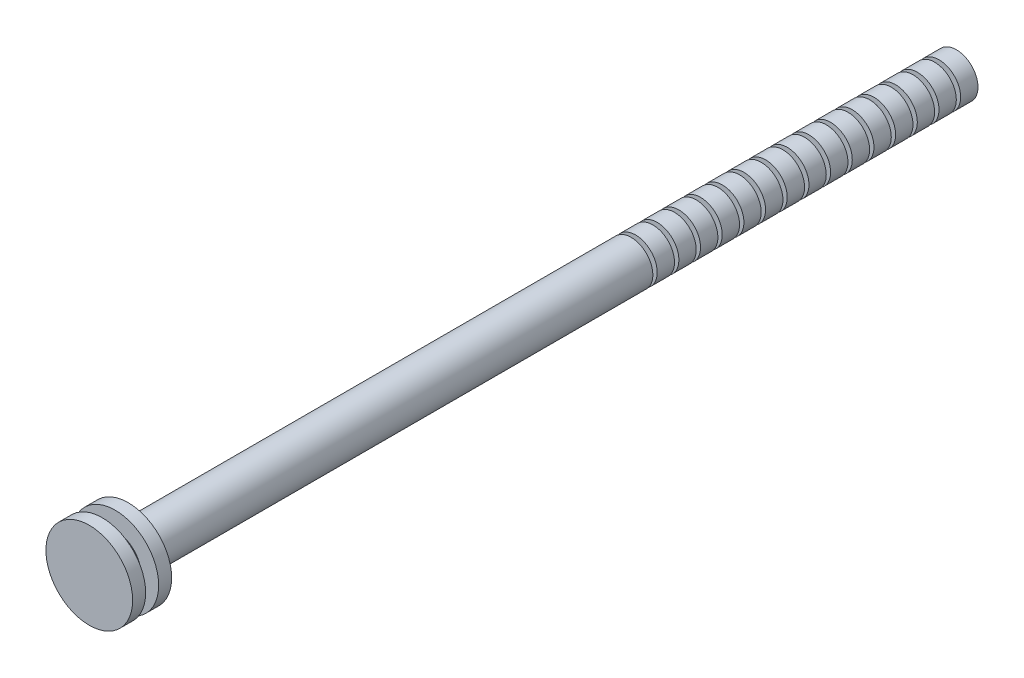
from build123d import *

# Parameters (mm, degrees)
SKETCH3_W       = 2
SKETCH3_H       = 1
LPATTERN1_COUNT = 15
LPATTERN1_PITCH = 5


with BuildPart() as part:
    # Sketch2 → Revolve1 (revolve)
    with BuildSketch(Plane(origin=(0, 0, 0), x_dir=(1, 0, 0), z_dir=(0, 1, 0))):
        Polygon((0, 0), (10, 0), (10, 3), (6, 3), (6, 6), (10, 6), (10, 9), (5, 9), (5, 200), (0, 200), align=None)
    revolve(axis=Axis((0, 0, 0), (0, 0, -1)))

    # Sketch3 → Cut-Revolve1 (revolve, cut)
    with BuildSketch(Plane(origin=(0, 0, 0), x_dir=(1, 0, 0), z_dir=(0, 1, 0))):
        with Locations((4, 195.5)):
            Rectangle(SKETCH3_W, SKETCH3_H)
    cut_revolve1 = revolve(axis=Axis((0, 0, 0), (0, 0, -1)), mode=Mode.SUBTRACT)

    # LPattern1: Cut-Revolve1 ×15
    with Locations(*[(0, 0, i * LPATTERN1_PITCH) for i in range(1, LPATTERN1_COUNT)]):
        add(cut_revolve1, mode=Mode.SUBTRACT)


solid = part.part
